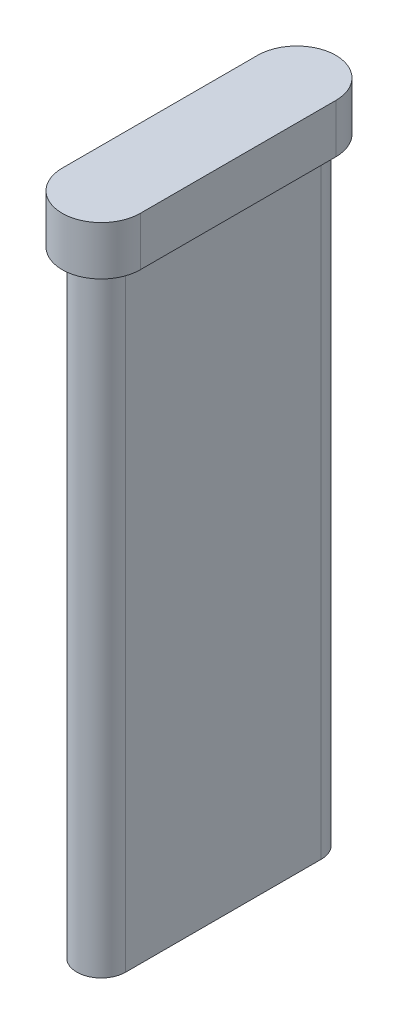
from build123d import *

# Parameters (mm, degrees)
BOSS_EXTRUDE1_DEPTH = 68
BOSS_EXTRUDE2_DEPTH = 5


with BuildPart() as part:
    # Sketch1 → Boss-Extrude1 (new body)
    with BuildSketch(Plane(origin=(0, 0, 0), x_dir=(1, 0, 0), z_dir=(0, 1, 0))):
        with BuildLine():
            Line((-2.5, -10), (-2.5, 10))
            ThreePointArc((-2.5, 10), (0, 12.5), (2.5, 10))
            Line((2.5, 10), (2.5, -10))
            ThreePointArc((2.5, -10), (0, -12.5), (-2.5, -10))
        make_face()
    extrude(amount=-BOSS_EXTRUDE1_DEPTH)

    # Sketch2 → Boss-Extrude2 (add)
    with BuildSketch(Plane(origin=(0, 0, 0), x_dir=(1, 0, 0), z_dir=(0, 1, 0))):
        with BuildLine():
            Line((4, -10), (4, 10))
            ThreePointArc((4, 10), (0, 14), (-4, 10))
            Line((-4, 10), (-4, -10))
            ThreePointArc((-4, -10), (0, -14), (4, -10))
        make_face()
    extrude(amount=-BOSS_EXTRUDE2_DEPTH)


solid = part.part
